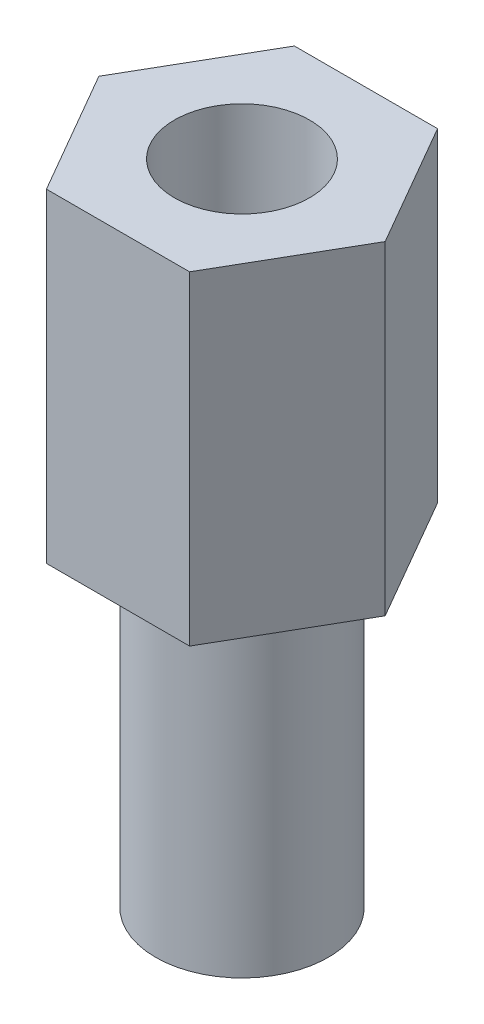
from build123d import *

# Parameters (mm, degrees)
EXTRUDE_1_DEPTH     = 6
SKETCH_6_R          = 1.6
EXTRUDE_2_DEPTH     = 6
SKETCH_7_R          = 1.25
CUT_EXTRUDE_1_DEPTH = 5


with BuildPart() as part:
    # 草图4 → 凸台-拉伸1 (new body)
    with BuildSketch(Plane(origin=(0, 0, 0), x_dir=(1, 0, 0), z_dir=(0, 1, 0))):
        Polygon((1.325, -2.29496732), (2.65, 0), (1.325, 2.29496732), (-1.325, 2.29496732), (-2.65, 0), (-1.325, -2.29496732), align=None)
    extrude(amount=EXTRUDE_1_DEPTH)

    # 草图6 → 凸台-拉伸2 (add)
    with BuildSketch(Plane(origin=(0, 0, 0), x_dir=(-1, 0, 0), z_dir=(0, -1, 0))):
        with Locations(Location((0, 0, 0), (0, 0, 270))):
            Circle(SKETCH_6_R)
    extrude(amount=EXTRUDE_2_DEPTH)

    # 草图7 → 切除-拉伸1 (cut)
    with BuildSketch(Plane(origin=(0, 6, 0), x_dir=(1, 0, 0), z_dir=(0, 1, 0))):
        with Locations(Location((0, 0, 0), (0, 0, 270))):
            Circle(SKETCH_7_R)
    extrude(amount=-CUT_EXTRUDE_1_DEPTH, mode=Mode.SUBTRACT)


solid = part.part
